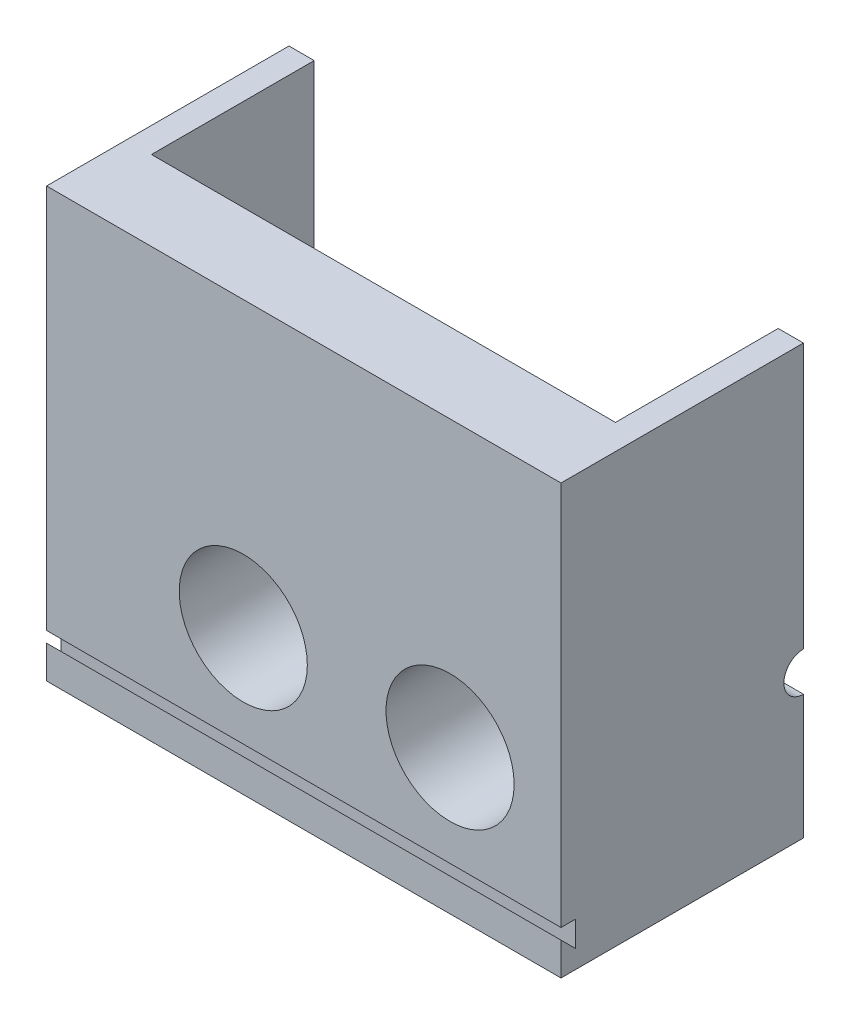
from build123d import *

# Parameters (mm, degrees)
SKETCH2_W           = 102
SKETCH2_H           = 96.13
SKETCH2_W_2         = 92
SKETCH2_H_2         = 64.53
BOSS_EXTRUDE1_DEPTH = 85
SKETCH8_R           = 12.7
CUT_EXTRUDE7_DEPTH  = 20
SKETCH9_R           = 10
CUT_EXTRUDE8_DEPTH  = 20
SKETCH10_R          = 3.875
CUT_EXTRUDE9_DEPTH  = 142.206388754
SKETCH11_W          = 48.065
SKETCH11_H          = 85
CUT_EXTRUDE11_DEPTH = 142.206388754
SKETCH12_R          = 1.6
CUT_EXTRUDE12_DEPTH = 10
SKETCH14_R          = 15.5
SKETCH14_R_2        = 12.7
BOSS_EXTRUDE2_DEPTH = 10
FILLET1_R           = 1.5
CUT_EXTRUDE13_DEPTH = 142.206388754


with BuildPart() as part:
    # Sketch2 → Boss-Extrude1 (new body)
    with BuildSketch(Plane(origin=(0, 0, 0), x_dir=(1, 0, 0), z_dir=(0, 1, 0))):
        Rectangle(SKETCH2_W, SKETCH2_H)
        Rectangle(SKETCH2_W_2, SKETCH2_H_2, mode=Mode.SUBTRACT)
    extrude(amount=BOSS_EXTRUDE1_DEPTH)

    # Sketch8 → Cut-Extrude7 (cut)
    with BuildSketch(Plane.XY.offset(48.065)):
        with Locations((-12, 28.575)):
            Circle(SKETCH8_R)
        with Locations((29, 28.575)):
            Circle(SKETCH8_R)
    extrude(amount=-CUT_EXTRUDE7_DEPTH, mode=Mode.SUBTRACT)

    # Sketch9 → Cut-Extrude8 (cut)
    with BuildSketch(Plane(origin=(0, 0, -48.065), x_dir=(-1, 0, 0), z_dir=(0, 0, -1))):
        with Locations((-31, 31.7)):
            Circle(SKETCH9_R)
        with Locations((29, 31.7)):
            Circle(SKETCH9_R)
    extrude(amount=-CUT_EXTRUDE8_DEPTH, mode=Mode.SUBTRACT)

    # Sketch10 → Cut-Extrude9 (cut, through all)
    with BuildSketch(Plane.ZY.offset(51)):
        with Locations((0, 28.575)):
            Circle(SKETCH10_R)
    extrude(amount=-CUT_EXTRUDE9_DEPTH, mode=Mode.SUBTRACT)

    # Sketch11 → Cut-Extrude11 (cut, through all)
    with BuildSketch(Plane.ZY.offset(51)):
        with Locations((-24.0325, 42.5)):
            Rectangle(SKETCH11_W, SKETCH11_H)
    extrude(amount=-CUT_EXTRUDE11_DEPTH, mode=Mode.SUBTRACT)

    # Sketch12 → Cut-Extrude12 (cut)
    with BuildSketch(Plane(origin=(0, 0, 0), x_dir=(-1, 0, 0), z_dir=(0, 0, -1))):
        with Locations(Location((-48.5, 58.725, 0), (0, 0, 90))):
            Circle(SKETCH12_R)
        with Locations(Location((-48.5, 4.675, 0), (0, 0, 270))):
            Circle(SKETCH12_R)
        with Locations(Location((48.5, 4.675, 0), (0, 0, 90))):
            Circle(SKETCH12_R)
        with Locations(Location((48.5, 58.725, 0), (0, 0, 270))):
            Circle(SKETCH12_R)
    extrude(amount=-CUT_EXTRUDE12_DEPTH, mode=Mode.SUBTRACT)

    # Sketch14 → Boss-Extrude2 (add)
    # profile 1 of 2: a face of its own
    with BuildSketch(Plane(origin=(0, 0, 32.265), x_dir=(-1, 0, 0), z_dir=(0, 0, -1))):
        with Locations((-29, 28.575)):
            Circle(SKETCH14_R)
        with Locations(Location((-29, 28.575, 0), (0, 0, 180))):
            Circle(SKETCH14_R_2, mode=Mode.SUBTRACT)
    # profile 2 of 2: a face of its own
    with BuildSketch(Plane(origin=(0, 0, 32.265), x_dir=(-1, 0, 0), z_dir=(0, 0, -1))):
        with Locations((12, 28.575)):
            Circle(SKETCH14_R)
        with Locations(Location((12, 28.575, 0), (0, 0, 180))):
            Circle(SKETCH14_R_2, mode=Mode.SUBTRACT)
    extrude(amount=BOSS_EXTRUDE2_DEPTH)

    # Fillet1
    fillet1_edges = [part.edges().sort_by_distance(p)[0] for p in [
        (16.3, 28.575, 22.265),
        (-24.7, 28.575, 22.265),
    ]]
    fillet(fillet1_edges, radius=FILLET1_R)

    # Sketch15 → Cut-Extrude13 (cut, through all)
    with BuildSketch(Plane(origin=(51, 0, 0), x_dir=(0, 0, -1), z_dir=(1, 0, 0))):
        Polygon((-48.065, 6.5), (-45.236572875, 3.671572875), (-45.236572875, 8.671572875), (-48.065, 8.671572875), align=None)
    extrude(amount=-CUT_EXTRUDE13_DEPTH, mode=Mode.SUBTRACT)


solid = part.part
